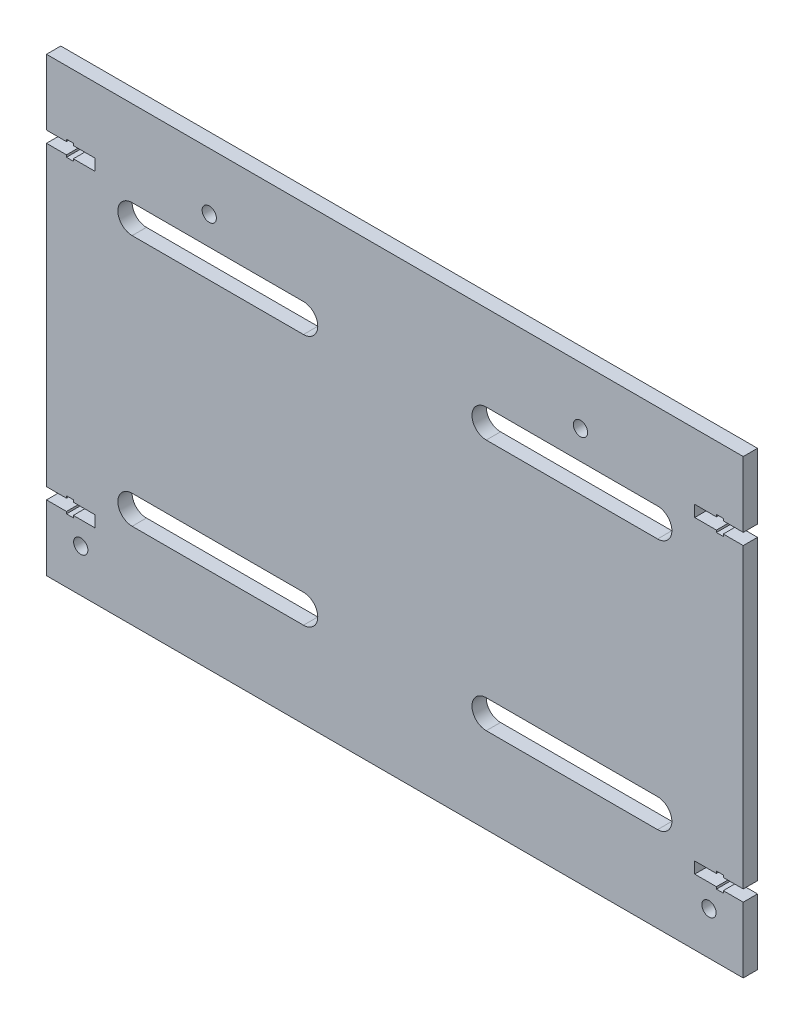
from build123d import *

# Parameters (mm, degrees)
SKETCH1_W           = 244
SKETCH1_H           = 158.15
BOSS_EXTRUDE1_DEPTH = 5
CUT_EXTRUDE1_DEPTH  = 10
CUT_EXTRUDE2_DEPTH  = 10
SKETCH4_R           = 2.5
CUT_EXTRUDE3_DEPTH  = 10


with BuildPart() as part:
    # Sketch1 → Boss-Extrude1 (new body)
    with BuildSketch(Plane.XY):
        with Locations((14.8, -10.925)):
            Rectangle(SKETCH1_W, SKETCH1_H)
    extrude(amount=BOSS_EXTRUDE1_DEPTH)

    # Sketch2 → Cut-Extrude1 (cut)
    with BuildSketch(Plane(origin=(0, 0, 0), x_dir=(-1, 0, 0), z_dir=(0, 0, -1))):
        Polygon((-136.8, 45.15), (-129.8, 45.15), (-129.8, 45.9), (-127.4, 45.9), (-127.4, 45.15), (-119.8, 45.15), (-119.8, 41.15), (-127.4, 41.15), (-127.4, 40.4), (-129.8, 40.4), (-129.8, 41.15), (-136.8, 41.15), align=None)
        Polygon((-129.8, -63), (-136.8, -63), (-136.8, -67), (-129.8, -67), (-129.8, -67.75), (-127.4, -67.75), (-127.4, -67), (-119.8, -67), (-119.8, -63), (-127.4, -63), (-127.4, -62.25), (-129.8, -62.25), align=None)
        Polygon((100.2, 41.15), (107.2, 41.15), (107.2, 45.15), (100.2, 45.15), (100.2, 45.9), (97.8, 45.9), (97.8, 45.15), (90.2, 45.15), (90.2, 41.15), (97.8, 41.15), (97.8, 40.4), (100.2, 40.4), align=None)
        Polygon((107.2, -67), (100.2, -67), (100.2, -67.75), (97.8, -67.75), (97.8, -67), (90.2, -67), (90.2, -63), (97.8, -63), (97.8, -62.25), (100.2, -62.25), (100.2, -63), (107.2, -63), align=None)
    extrude(amount=-CUT_EXTRUDE1_DEPTH, mode=Mode.SUBTRACT)

    # Sketch3 → Cut-Extrude2 (cut)
    with BuildSketch(Plane(origin=(0, 0, 0), x_dir=(-1, 0, 0), z_dir=(0, 0, -1))):
        with BuildLine():
            Line((-106.8, 38.15), (-46.8, 38.15))
            ThreePointArc((-46.8, 38.15), (-41.8, 33.15), (-46.8, 28.15))
            Line((-46.8, 28.15), (-106.8, 28.15))
            ThreePointArc((-106.8, 28.15), (-111.8, 33.15), (-106.8, 38.15))
        make_face()
        with BuildLine():
            Line((-46.8, -50), (-106.8, -50))
            ThreePointArc((-106.8, -50), (-111.8, -55), (-106.8, -60))
            Line((-106.8, -60), (-46.8, -60))
            ThreePointArc((-46.8, -60), (-41.8, -55), (-46.8, -50))
        make_face()
        with BuildLine():
            Line((77.2, -60), (17.2, -60))
            ThreePointArc((17.2, -60), (12.2, -55), (17.2, -50))
            Line((17.2, -50), (77.2, -50))
            ThreePointArc((77.2, -50), (82.2, -55), (77.2, -60))
        make_face()
        with BuildLine():
            Line((17.2, 28.15), (77.2, 28.15))
            ThreePointArc((77.2, 28.15), (82.2, 33.15), (77.2, 38.15))
            Line((77.2, 38.15), (17.2, 38.15))
            ThreePointArc((17.2, 38.15), (12.2, 33.15), (17.2, 28.15))
        make_face()
    extrude(amount=-CUT_EXTRUDE2_DEPTH, mode=Mode.SUBTRACT)

    # Sketch4 → Cut-Extrude3 (cut)
    with BuildSketch(Plane(origin=(0, 0, 0), x_dir=(-1, 0, 0), z_dir=(0, 0, -1))):
        with Locations((50.2, 48.15)):
            Circle(SKETCH4_R)
        with Locations((-79.8, 48.15)):
            Circle(SKETCH4_R)
        with Locations((-124.8, -75.004567899)):
            Circle(SKETCH4_R)
        with Locations((95.2, -75.004567899)):
            Circle(SKETCH4_R)
    extrude(amount=-CUT_EXTRUDE3_DEPTH, mode=Mode.SUBTRACT)


solid = part.part
